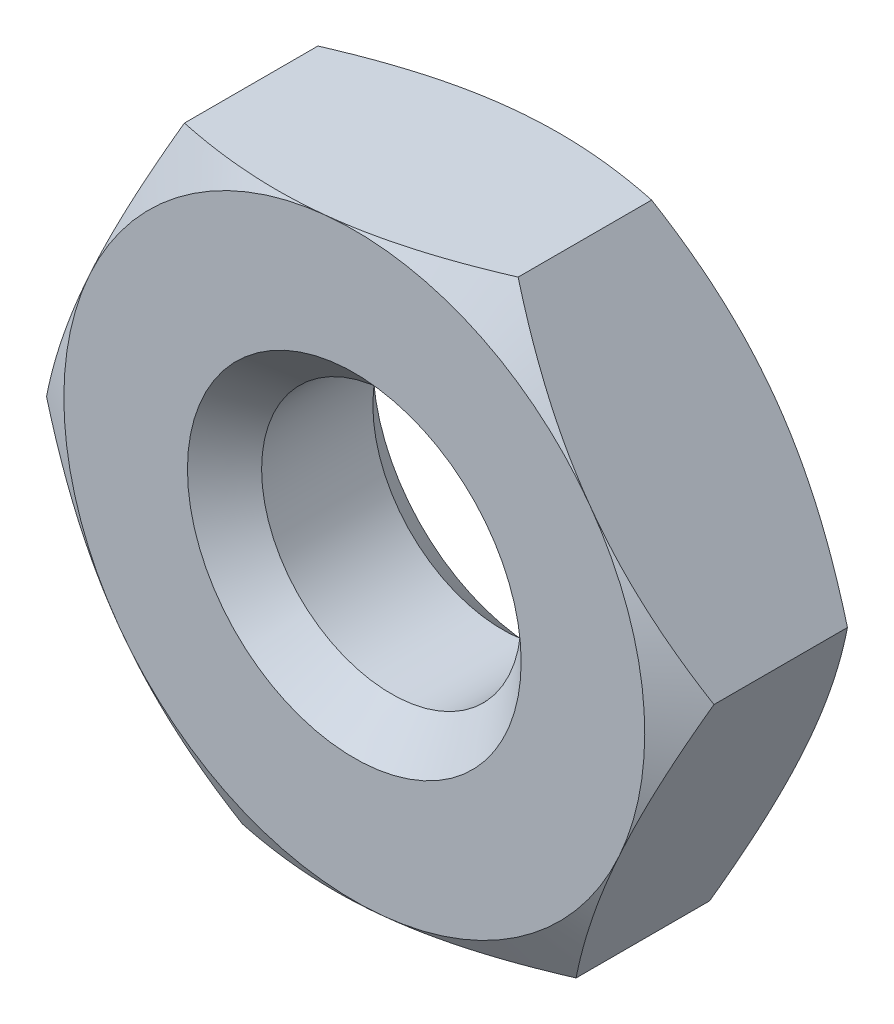
from build123d import *

# Parameters (mm, degrees)
SKICA1_R                = 1.05
P_IDAT_VYSUNUT_M1_DEPTH = 1.5
ZKOSEN_1_SIZE           = 0.3


with BuildPart() as part:
    # Skica1 → Přidat vysunutím1 (new body)
    with BuildSketch(Plane.XY):
        Polygon((1.115479212, 2.47366923), (-1.584520788, 2.20286795), (-2.7, -0.27080128), (-1.115479212, -2.47366923), (1.584520788, -2.20286795), (2.7, 0.27080128), align=None)
        Circle(SKICA1_R, mode=Mode.SUBTRACT)
    extrude(amount=P_IDAT_VYSUNUT_M1_DEPTH)

    # Skica2 → Odebrat rotací1 (revolve, cut)
    with BuildSketch(Plane(origin=(0, 0, 0), x_dir=(0.911600167657697, -0.41107801489067575, 0), z_dir=(0.41107801489067575, 0.911600167657697, 0))):
        Polygon((-3.649038106, -1.5), (-2.35, -1.5), (-3.649038106, -0.75), align=None)
        Polygon((-3.649038106, -0.75), (-2.35, 0), (-3.649038106, 0), align=None)
    revolve(axis=Axis((0, 0, 0.75), (0, 0, 1)), mode=Mode.SUBTRACT)

    # Zkosení1
    zkosen_1_edges = [part.edges().sort_by_distance(p)[0] for p in [
        (-1.05, 0, 0),
        (-1.05, 0, 1.5),
    ]]
    chamfer(zkosen_1_edges, length=ZKOSEN_1_SIZE)


solid = part.part
